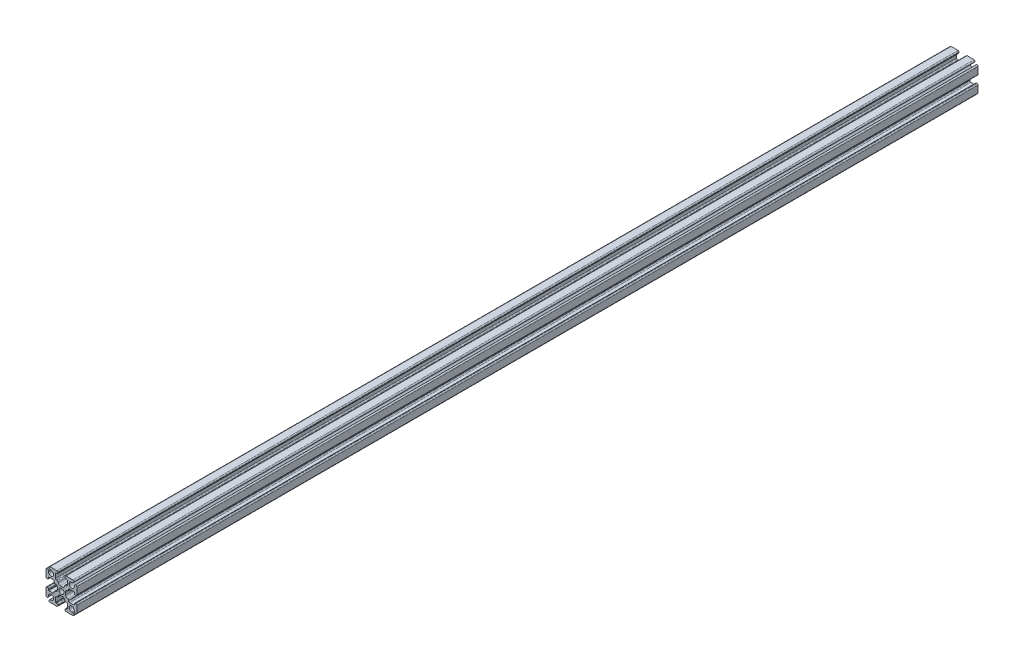
from build123d import *

# Parameters (mm, degrees)
SKETCH1_R           = 1.25
BOSS_EXTRUDE1_DEPTH = 438.15


with BuildPart() as part:
    # Sketch1 → Boss-Extrude1 (new body)
    with BuildSketch(Plane.XY):
        with BuildLine():
            Line((6.646446609, 5.939339828), (6.163645978, 5.456539197))
            ThreePointArc((6.163645978, 5.456539197), (4.116116524, 4.116116524), (5.456539197, 6.163645978))
            Line((5.456539197, 6.163645978), (5.939339828, 6.646446609))
            ThreePointArc((5.939339828, 6.646446609), (6.047726204, 7.191341716), (5.585786438, 7.5))
            Line((5.585786438, 7.5), (2.25, 7.5))
            ThreePointArc((2.25, 7.5), (1.896446609, 7.353553391), (1.75, 7))
            Line((1.75, 7), (1.75, 6.8))
            ThreePointArc((1.75, 6.8), (1.896446609, 6.446446609), (2.25, 6.3))
            Line((2.25, 6.3), (2.65, 6.3))
            ThreePointArc((2.65, 6.3), (2.791421356, 6.241421356), (2.85, 6.1))
            Line((2.85, 6.1), (2.85, 4))
            ThreePointArc((2.85, 4), (2.703553391, 3.646446609), (2.35, 3.5))
            Line((2.35, 3.5), (2.1, 3.5))
            ThreePointArc((2.1, 3.5), (1.746446609, 3.353553391), (1.6, 3))
            ThreePointArc((1.6, 3), (1.307106781, 2.292893219), (0.6, 2))
            Line((0.6, 2), (-0.6, 2))
            ThreePointArc((-0.6, 2), (-1.307106781, 2.292893219), (-1.6, 3))
            ThreePointArc((-1.6, 3), (-1.746446609, 3.353553391), (-2.1, 3.5))
            Line((-2.1, 3.5), (-2.35, 3.5))
            ThreePointArc((-2.35, 3.5), (-2.703553391, 3.646446609), (-2.85, 4))
            Line((-2.85, 4), (-2.85, 6.1))
            ThreePointArc((-2.85, 6.1), (-2.791421356, 6.241421356), (-2.65, 6.3))
            Line((-2.65, 6.3), (-2.25, 6.3))
            ThreePointArc((-2.25, 6.3), (-1.896446609, 6.446446609), (-1.75, 6.8))
            Line((-1.75, 6.8), (-1.75, 7))
            ThreePointArc((-1.75, 7), (-1.896446609, 7.353553391), (-2.25, 7.5))
            Line((-2.25, 7.5), (-5.585786438, 7.5))
            ThreePointArc((-5.585786438, 7.5), (-6.047726204, 7.191341716), (-5.939339828, 6.646446609))
            Line((-5.939339828, 6.646446609), (-5.456539197, 6.163645978))
            ThreePointArc((-5.456539197, 6.163645978), (-4.116116524, 4.116116524), (-6.163645978, 5.456539197))
            Line((-6.163645978, 5.456539197), (-6.646446609, 5.939339828))
            ThreePointArc((-6.646446609, 5.939339828), (-7.191341716, 6.047726204), (-7.5, 5.585786438))
            Line((-7.5, 5.585786438), (-7.5, 2.25))
            ThreePointArc((-7.5, 2.25), (-7.353553391, 1.896446609), (-7, 1.75))
            Line((-7, 1.75), (-6.8, 1.75))
            ThreePointArc((-6.8, 1.75), (-6.446446609, 1.896446609), (-6.3, 2.25))
            Line((-6.3, 2.25), (-6.3, 2.65))
            ThreePointArc((-6.3, 2.65), (-6.241421356, 2.791421356), (-6.1, 2.85))
            Line((-6.1, 2.85), (-4, 2.85))
            ThreePointArc((-4, 2.85), (-3.646446609, 2.703553391), (-3.5, 2.35))
            Line((-3.5, 2.35), (-3.5, 2.1))
            ThreePointArc((-3.5, 2.1), (-3.353553391, 1.746446609), (-3, 1.6))
            ThreePointArc((-3, 1.6), (-2.292893219, 1.307106781), (-2, 0.6))
            Line((-2, 0.6), (-2, -0.6))
            ThreePointArc((-2, -0.6), (-2.292893219, -1.307106781), (-3, -1.6))
            ThreePointArc((-3, -1.6), (-3.353553391, -1.746446609), (-3.5, -2.1))
            Line((-3.5, -2.1), (-3.5, -2.35))
            ThreePointArc((-3.5, -2.35), (-3.646446609, -2.703553391), (-4, -2.85))
            Line((-4, -2.85), (-6.1, -2.85))
            ThreePointArc((-6.1, -2.85), (-6.241421356, -2.791421356), (-6.3, -2.65))
            Line((-6.3, -2.65), (-6.3, -2.25))
            ThreePointArc((-6.3, -2.25), (-6.446446609, -1.896446609), (-6.8, -1.75))
            Line((-6.8, -1.75), (-7, -1.75))
            ThreePointArc((-7, -1.75), (-7.353553391, -1.896446609), (-7.5, -2.25))
            Line((-7.5, -2.25), (-7.5, -5.585786438))
            ThreePointArc((-7.5, -5.585786438), (-7.191341716, -6.047726204), (-6.646446609, -5.939339828))
            Line((-6.646446609, -5.939339828), (-6.163645978, -5.456539197))
            ThreePointArc((-6.163645978, -5.456539197), (-4.116116524, -4.116116524), (-5.456539197, -6.163645978))
            Line((-5.456539197, -6.163645978), (-5.939339828, -6.646446609))
            ThreePointArc((-5.939339828, -6.646446609), (-6.047726204, -7.191341716), (-5.585786438, -7.5))
            Line((-5.585786438, -7.5), (-2.25, -7.5))
            ThreePointArc((-2.25, -7.5), (-1.896446609, -7.353553391), (-1.75, -7))
            Line((-1.75, -7), (-1.75, -6.8))
            ThreePointArc((-1.75, -6.8), (-1.896446609, -6.446446609), (-2.25, -6.3))
            Line((-2.25, -6.3), (-2.65, -6.3))
            ThreePointArc((-2.65, -6.3), (-2.791421356, -6.241421356), (-2.85, -6.1))
            Line((-2.85, -6.1), (-2.85, -4))
            ThreePointArc((-2.85, -4), (-2.703553391, -3.646446609), (-2.35, -3.5))
            Line((-2.35, -3.5), (-2.1, -3.5))
            ThreePointArc((-2.1, -3.5), (-1.746446609, -3.353553391), (-1.6, -3))
            ThreePointArc((-1.6, -3), (-1.307106781, -2.292893219), (-0.6, -2))
            Line((-0.6, -2), (0.6, -2))
            ThreePointArc((0.6, -2), (1.307106781, -2.292893219), (1.6, -3))
            ThreePointArc((1.6, -3), (1.746446609, -3.353553391), (2.1, -3.5))
            Line((2.1, -3.5), (2.35, -3.5))
            ThreePointArc((2.35, -3.5), (2.703553391, -3.646446609), (2.85, -4))
            Line((2.85, -4), (2.85, -6.1))
            ThreePointArc((2.85, -6.1), (2.791421356, -6.241421356), (2.65, -6.3))
            Line((2.65, -6.3), (2.25, -6.3))
            ThreePointArc((2.25, -6.3), (1.896446609, -6.446446609), (1.75, -6.8))
            Line((1.75, -6.8), (1.75, -7))
            ThreePointArc((1.75, -7), (1.896446609, -7.353553391), (2.25, -7.5))
            Line((2.25, -7.5), (5.585786438, -7.5))
            ThreePointArc((5.585786438, -7.5), (6.047726204, -7.191341716), (5.939339828, -6.646446609))
            Line((5.939339828, -6.646446609), (5.456539197, -6.163645978))
            ThreePointArc((5.456539197, -6.163645978), (4.116116524, -4.116116524), (6.163645978, -5.456539197))
            Line((6.163645978, -5.456539197), (6.646446609, -5.939339828))
            ThreePointArc((6.646446609, -5.939339828), (7.191341716, -6.047726204), (7.5, -5.585786438))
            Line((7.5, -5.585786438), (7.5, -2.25))
            ThreePointArc((7.5, -2.25), (7.353553391, -1.896446609), (7, -1.75))
            Line((7, -1.75), (6.8, -1.75))
            ThreePointArc((6.8, -1.75), (6.446446609, -1.896446609), (6.3, -2.25))
            Line((6.3, -2.25), (6.3, -2.65))
            ThreePointArc((6.3, -2.65), (6.241421356, -2.791421356), (6.1, -2.85))
            Line((6.1, -2.85), (4, -2.85))
            ThreePointArc((4, -2.85), (3.646446609, -2.703553391), (3.5, -2.35))
            Line((3.5, -2.35), (3.5, -2.1))
            ThreePointArc((3.5, -2.1), (3.353553391, -1.746446609), (3, -1.6))
            ThreePointArc((3, -1.6), (2.292893219, -1.307106781), (2, -0.6))
            Line((2, -0.6), (2, 0.6))
            ThreePointArc((2, 0.6), (2.292893219, 1.307106781), (3, 1.6))
            ThreePointArc((3, 1.6), (3.353553391, 1.746446609), (3.5, 2.1))
            Line((3.5, 2.1), (3.5, 2.35))
            ThreePointArc((3.5, 2.35), (3.646446609, 2.703553391), (4, 2.85))
            Line((4, 2.85), (6.1, 2.85))
            ThreePointArc((6.1, 2.85), (6.241421356, 2.791421356), (6.3, 2.65))
            Line((6.3, 2.65), (6.3, 2.25))
            ThreePointArc((6.3, 2.25), (6.446446609, 1.896446609), (6.8, 1.75))
            Line((6.8, 1.75), (7, 1.75))
            ThreePointArc((7, 1.75), (7.353553391, 1.896446609), (7.5, 2.25))
            Line((7.5, 2.25), (7.5, 5.585786438))
            ThreePointArc((7.5, 5.585786438), (7.191341716, 6.047726204), (6.646446609, 5.939339828))
        make_face()
        with Locations(Location((0, 0, 0), (0, 0, 180))):
            Circle(SKETCH1_R, mode=Mode.SUBTRACT)
    extrude(amount=BOSS_EXTRUDE1_DEPTH)


solid = part.part
